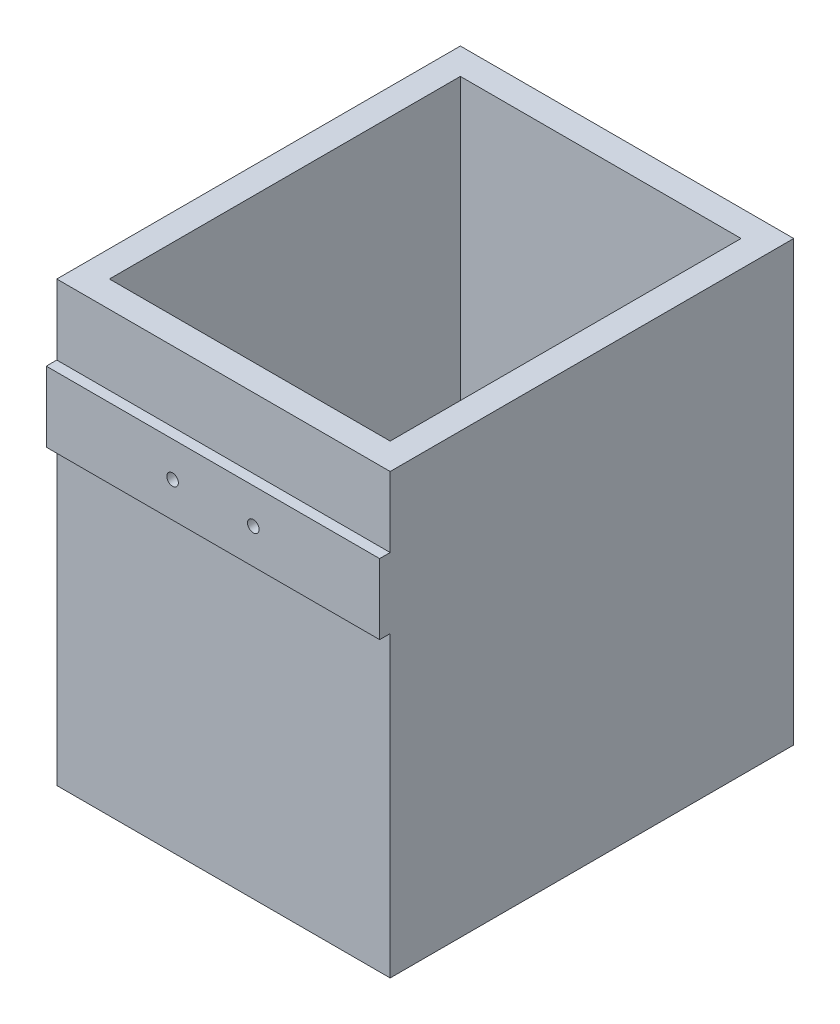
from build123d import *

# Parameters (mm, degrees)
SKETCH1_W           = 80
SKETCH1_H           = 100
BOSS_EXTRUDE1_DEPTH = 9
SKETCH2_W           = 68
SKETCH2_H           = 85.4
CUT_EXTRUDE1_DEPTH  = 7
SKETCH3_W           = 95
SKETCH3_H           = 115
SKETCH3_W_2         = 80
SKETCH3_H_2         = 100
BOSS_EXTRUDE2_DEPTH = 125
SKETCH6_W           = 95
SKETCH6_H           = 20
BOSS_EXTRUDE4_DEPTH = 3
SKETCH7_R           = 1.65
CUT_EXTRUDE2_DEPTH  = 10.5
SKETCH9_R           = 3
CUT_EXTRUDE3_DEPTH  = 3.2


with BuildPart() as part:
    # Sketch1 → Boss-Extrude1 (new body)
    with BuildSketch(Plane(origin=(0, 0, 0), x_dir=(1, 0, 0), z_dir=(0, 1, 0))):
        Rectangle(SKETCH1_W, SKETCH1_H)
    extrude(amount=BOSS_EXTRUDE1_DEPTH)

    # Sketch2 → Cut-Extrude1 (cut)
    with BuildSketch(Plane(origin=(0, 9, 0), x_dir=(1, 0, 0), z_dir=(0, 1, 0))):
        Rectangle(SKETCH2_W, SKETCH2_H)
    extrude(amount=-CUT_EXTRUDE1_DEPTH, mode=Mode.SUBTRACT)

    # Sketch3 → Boss-Extrude2 (add)
    with BuildSketch(Plane.XZ):
        Rectangle(SKETCH3_W, SKETCH3_H)
        Rectangle(SKETCH3_W_2, SKETCH3_H_2, mode=Mode.SUBTRACT)
    extrude(amount=-BOSS_EXTRUDE2_DEPTH)

    # Sketch6 → Boss-Extrude4 (add)
    with BuildSketch(Plane.XY.offset(57.5)):
        with Locations((0, 95)):
            Rectangle(SKETCH6_W, SKETCH6_H)
    extrude(amount=BOSS_EXTRUDE4_DEPTH)

    # Sketch7 → Cut-Extrude2 (cut)
    with BuildSketch(Plane.XY.offset(60.5)):
        with Locations((-11.5, 95)):
            Circle(SKETCH7_R)
        with Locations((11.5, 95)):
            Circle(SKETCH7_R)
    extrude(amount=-CUT_EXTRUDE2_DEPTH, mode=Mode.SUBTRACT)

    # Sketch9 → Cut-Extrude3 (cut)
    with BuildSketch(Plane(origin=(0, 0, 50), x_dir=(-1, 0, 0), z_dir=(0, 0, -1))):
        with Locations((-11.5, 95)):
            Circle(SKETCH9_R)
        with Locations((11.5, 95)):
            Circle(SKETCH9_R)
    extrude(amount=-CUT_EXTRUDE3_DEPTH, mode=Mode.SUBTRACT)


solid = part.part
